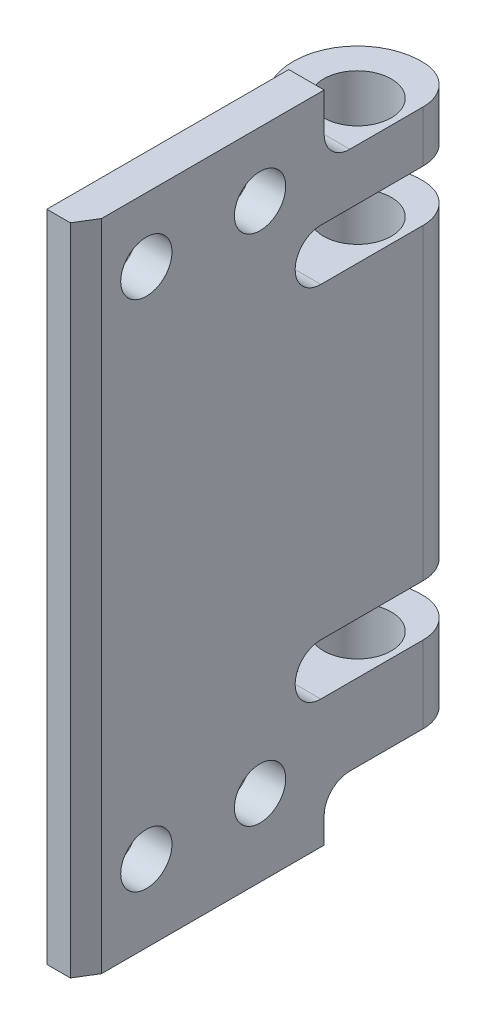
from build123d import *

# Parameters (mm, degrees)
BOSS_EXTRUDE5_DEPTH          = 2.760049195
CHAMFER1_SIZE                = 1.510362865
CHAMFER1_SIZE2               = 0.926037145
BOSS_EXTRUDE6_DEPTH          = 24
BOSS_EXTRUDE7_DEPTH          = 5
BOSS_EXTRUDE8_DEPTH          = 6
BOSS_EXTRUDE9_DEPTH          = 4
SKETCH28_W                   = 2.760049196
SKETCH28_H                   = 4
CUT_EXTRUDE3_DEPTH           = 8.878692186
BOSS_EXTRUDE10_START         = 4
BOSS_EXTRUDE10_DEPTH         = 4
SKETCH45_W                   = 2.760049196
SKETCH45_H                   = 4
CUT_EXTRUDE4_DEPTH           = 0.7448337
BOSS_EXTRUDE11_DEPTH         = 5
F_4_0_4_DIAMETER_HOLE2_D     = 4
SKETCH58_W                   = 2.6375
SKETCH58_H                   = 10
SKETCH60_W                   = 2.6375
SKETCH60_H                   = 38
HOLE6_D                      = 5.275
HOLE6_DEPTH                  = 46
F_3_0_3_DIAMETER_HOLE2_D     = 3
F_3_0_3_DIAMETER_HOLE2_DEPTH = 35
FILLET3_R                    = 2
FILLET4_R                    = 3


with BuildPart() as part:
    # Sketch17 → Boss-Extrude5 (new body)
    with BuildSketch(Plane(origin=(57.196631886, 0, 0), x_dir=(0, -1, 0), z_dir=(-1, 0, 0))):
        with BuildLine():
            Line((-38, -27.633835998), (-14, -27.633835998))
            ThreePointArc((-14, -27.633835998), (-12, -25.633835998), (-10, -27.633835998))
            Line((-10, -27.633835998), (-10, -9.028355512))
            Line((-10, -9.028355512), (-42, -9.028355512))
            Line((-42, -9.028355512), (-42, -27.633835998))
            ThreePointArc((-42, -27.633835998), (-40, -25.633835998), (-38, -27.633835998))
        make_face()
    extrude(amount=-BOSS_EXTRUDE5_DEPTH)

    # Chamfer1
    chamfer1_edges = [part.edges().sort_by_distance(p)[0] for p in [
        (59.956681082, 26, -9.028355512),
    ]]
    chamfer1_side = [part.faces().sort_by_distance(p)[0] for p in [
        (59.956681082, 26, -18.148814744),
    ]]
    chamfer(chamfer1_edges, length=CHAMFER1_SIZE, length2=CHAMFER1_SIZE2, reference=chamfer1_side[0])

    # Sketch18 → Boss-Extrude6 (add)
    with BuildSketch(Plane(origin=(0, 38, 0), x_dir=(1, 0, 0), z_dir=(0, 1, 0))):
        with BuildLine():
            Line((57.196631886, 27.633835998), (59.956681082, 27.633835998))
            Line((59.956681082, 27.633835998), (59.956681082, 37.518663649))
            ThreePointArc((59.956681082, 37.518663649), (52.044420209, 35.109942461), (57.196631886, 28.639971463))
            Line((57.196631886, 28.639971463), (57.196631886, 27.633835998))
        make_face()
    extrude(amount=-BOSS_EXTRUDE6_DEPTH)

    # Sketch19 → Boss-Extrude7 (add)
    with BuildSketch(Plane(origin=(0, 35, 0), x_dir=(1, 0, 0), z_dir=(0, 1, 0))):
        with BuildLine():
            Line((57.196631886, 15.88036097), (57.196631886, 23.207838196))
            add(Edge.make_bspline(
                [(55.511713205, 21.752088745), (56.732163203, 22.065636669), (57.196631886, 23.207838196)],
                knots=[0, 0, 0, 1, 1, 1], degree=2))
            ThreePointArc((55.511713205, 21.752088745), (53.511713205, 19.752088745), (55.511713205, 17.752088745))
            add(Edge.make_bspline(
                [(57.196631886, 15.88036097), (56.909946197, 17.31678815), (55.511713205, 17.752088745)],
                knots=[0, 0, 0, 1, 1, 1], degree=2))
        make_face()
    extrude(amount=-BOSS_EXTRUDE7_DEPTH)

    # Sketch20 → Boss-Extrude8 (add)
    with BuildSketch(Plane.XZ.offset(-10)):
        with BuildLine():
            Line((57.196631886, -28.639971463), (57.196631886, -9.028355512))
            Line((57.196631886, -9.028355512), (59.030643937, -9.028355512))
            Line((59.030643937, -9.028355512), (59.956681082, -10.538718377))
            Line((59.956681082, -10.538718377), (59.956681082, -37.518663649))
            ThreePointArc((59.956681082, -37.518663649), (52.044420209, -35.109942461), (57.196631886, -28.639971463))
        make_face()
    extrude(amount=BOSS_EXTRUDE8_DEPTH)

    # Sketch21 → Boss-Extrude9 (add)
    with BuildSketch(Plane.XZ.offset(-4)):
        Polygon((57.196631886, -27.895137764), (57.196631886, -9.028355512), (59.030643937, -9.028355512), (59.956681082, -10.538718377), (59.956681082, -27.895137764), (59.956681082, -28.639971463), (59.956681082, -37.518663649), (57.196631886, -37.518663649), (57.196631886, -28.639971463), align=None)
    extrude(amount=BOSS_EXTRUDE9_DEPTH)

    # Sketch28 → Cut-Extrude3 (cut)
    with BuildSketch(Plane(origin=(0, 0, -37.518663649), x_dir=(-1, 0, 0), z_dir=(0, 0, -1))):
        with Locations((-58.576656484, 2)):
            Rectangle(SKETCH28_W, SKETCH28_H)
    extrude(amount=-CUT_EXTRUDE3_DEPTH, mode=Mode.SUBTRACT)

    # Sketch36 → Boss-Extrude10 (add)
    with BuildSketch(Plane(origin=(0, 42, 0), x_dir=(1, 0, 0), z_dir=(0, 1, 0)).offset(BOSS_EXTRUDE10_START)):
        with BuildLine():
            Line((59.956681082, 37.518663649), (59.956681082, 10.538718377))
            Line((59.956681082, 10.538718377), (59.030643937, 9.028355512))
            Line((59.030643937, 9.028355512), (57.196631886, 9.028355512))
            Line((57.196631886, 9.028355512), (57.196631886, 28.639971463))
            ThreePointArc((57.196631886, 28.639971463), (52.044420209, 35.109942461), (59.956681082, 37.518663649))
        make_face()
    extrude(amount=-BOSS_EXTRUDE10_DEPTH)

    # Sketch45 → Cut-Extrude4 (cut)
    with BuildSketch(Plane(origin=(0, 0, -28.639971463), x_dir=(-1, 0, 0), z_dir=(0, 0, -1))):
        with Locations((-58.576656484, 2)):
            Rectangle(SKETCH45_W, SKETCH45_H)
    extrude(amount=-CUT_EXTRUDE4_DEPTH, mode=Mode.SUBTRACT)

    # Sketch55 → Boss-Extrude11 (add)
    with BuildSketch(Plane(origin=(0, 46, 0), x_dir=(1, 0, 0), z_dir=(0, 1, 0))):
        Polygon((59.956681082, 10.538718377), (59.030643937, 9.028355512), (57.196631886, 9.028355512), (57.196631886, 27.895137764), (59.956681082, 27.895137764), align=None)
    extrude(amount=BOSS_EXTRUDE11_DEPTH)

    # Ø4.0 (4) Diameter Hole2 (through all)
    with Locations(Plane.ZY.offset(-57.196631886)):
        with Locations((-22.895137764, 6), (-14.028355512, 6), (-14.028355512, 46), (-22.895137764, 46)):
            Hole(F_4_0_4_DIAMETER_HOLE2_D / 2)

    # Sketch58 → Hole4 (revolve, cut)
    with BuildSketch(Plane(origin=(56.81904117, 10, -33.625693603), x_dir=(0, 0, 1), z_dir=(1, 0, 0))):
        with Locations((1.31875, 5)):
            Rectangle(SKETCH58_W, SKETCH58_H)
    revolve(axis=Axis((56.81904117, -100, -33.625693603), (0, 1, 0)), mode=Mode.SUBTRACT)

    # Sketch60 → Hole5 (revolve, cut)
    with BuildSketch(Plane(origin=(56.81904117, 38, -33.625693603), x_dir=(0, 0, 1), z_dir=(1, 0, 0))):
        with Locations((1.31875, 19)):
            Rectangle(SKETCH60_W, SKETCH60_H)
    revolve(axis=Axis((56.81904117, -72, -33.625693603), (0, 1, 0)), mode=Mode.SUBTRACT)

    # Hole6
    with Locations(Plane(origin=(0, 46, 0), x_dir=(1, 0, 0), z_dir=(0, 1, 0))):
        with Locations((56.81904117, 33.625693603)):
            Hole(HOLE6_D / 2, depth=HOLE6_DEPTH)

    # Ø3.0 (3) Diameter Hole2
    with Locations(Plane(origin=(0, 35, 0), x_dir=(1, 0, 0), z_dir=(0, 1, 0))):
        with Locations((55.511713205, 19.752088745)):
            Hole(F_3_0_3_DIAMETER_HOLE2_D / 2, depth=F_3_0_3_DIAMETER_HOLE2_DEPTH)

    # Fillet3
    fillet3_edges = [part.edges().sort_by_distance(p)[0] for p in [
        (58.576656484, 46, -27.895137764),
        (58.576656484, 4, -27.895137764),
        (57.196631886, 26, -28.639971463),
    ]]
    fillet(fillet3_edges, radius=FILLET3_R)

    # Fillet4
    fillet4_edges = [part.edges().sort_by_distance(p)[0] for p in [
        (59.956681082, 26, -37.518663649),
        (59.956681082, 7, -37.518663649),
        (59.956681082, 44, -37.518663649),
    ]]
    fillet(fillet4_edges, radius=FILLET4_R)


solid = part.part
